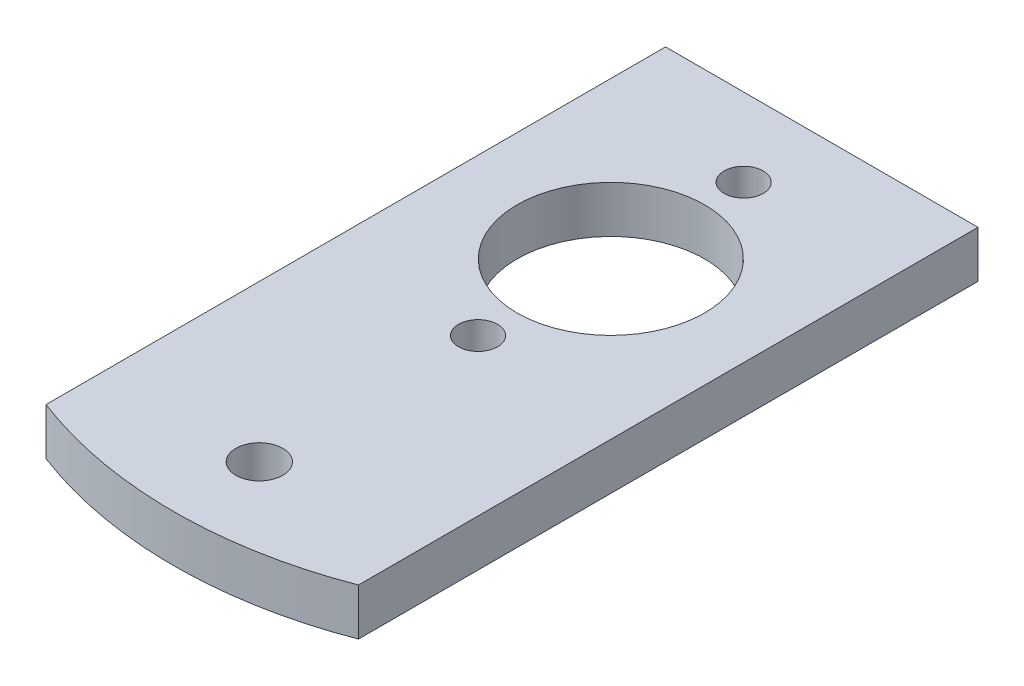
from build123d import *

# Parameters (mm, degrees)
SKETCH1_W               = 20
SKETCH1_H               = 46
SKETCH1_R               = 1.25
SKETCH1_R_2             = 6
SKETCH1_R_3             = 1.5
BOSS_EXTRUDE1_DEPTH     = 3
CUT_EXTRUDE1_DEPTH      = 26.258661881
CUT_EXTRUDE1_DEPTH_BACK = 26.258661881
SKETCH2_W               = 20
SKETCH2_H               = 13.653393661


with BuildPart() as part:
    # Sketch1 → Boss-Extrude1 (new body)
    with BuildSketch(Plane(origin=(0, 0, 0), x_dir=(1, 0, 0), z_dir=(0, 1, 0))):
        Rectangle(SKETCH1_W, SKETCH1_H)
        with Locations(Location((0, 18, 0), (0, 0, 270))):
            Circle(SKETCH1_R, mode=Mode.SUBTRACT)
        with Locations(Location((0, 9.5, 0), (0, 0, 270))):
            Circle(SKETCH1_R_2, mode=Mode.SUBTRACT)
        with Locations(Location((0, 1, 0), (0, 0, 90))):
            Circle(SKETCH1_R, mode=Mode.SUBTRACT)
        with Locations(Location((0, -13, 0), (0, 0, 270))):
            Circle(SKETCH1_R_3, mode=Mode.SUBTRACT)
    extrude(amount=BOSS_EXTRUDE1_DEPTH)

    # Sketch2 → Cut-Extrude1 (cut, two sides: drawn at the far end of the back side and taken through both)
    with BuildSketch(Plane(origin=(0, 3, 0), x_dir=(1, 0, 0), z_dir=(0, 1, 0)).offset(-CUT_EXTRUDE1_DEPTH_BACK)):
        with Locations((0, -29.826696831)):
            Rectangle(SKETCH2_W, SKETCH2_H)
        with BuildLine():
            ThreePointArc((10, -16.653393661), (0, -18.5), (-10, -16.653393661))
            Line((-10, -16.653393661), (-10, -23))
            Line((-10, -23), (10, -23))
            Line((10, -23), (10, -16.653393661))
        make_face()
    extrude(amount=CUT_EXTRUDE1_DEPTH + CUT_EXTRUDE1_DEPTH_BACK, mode=Mode.SUBTRACT)


solid = part.part
